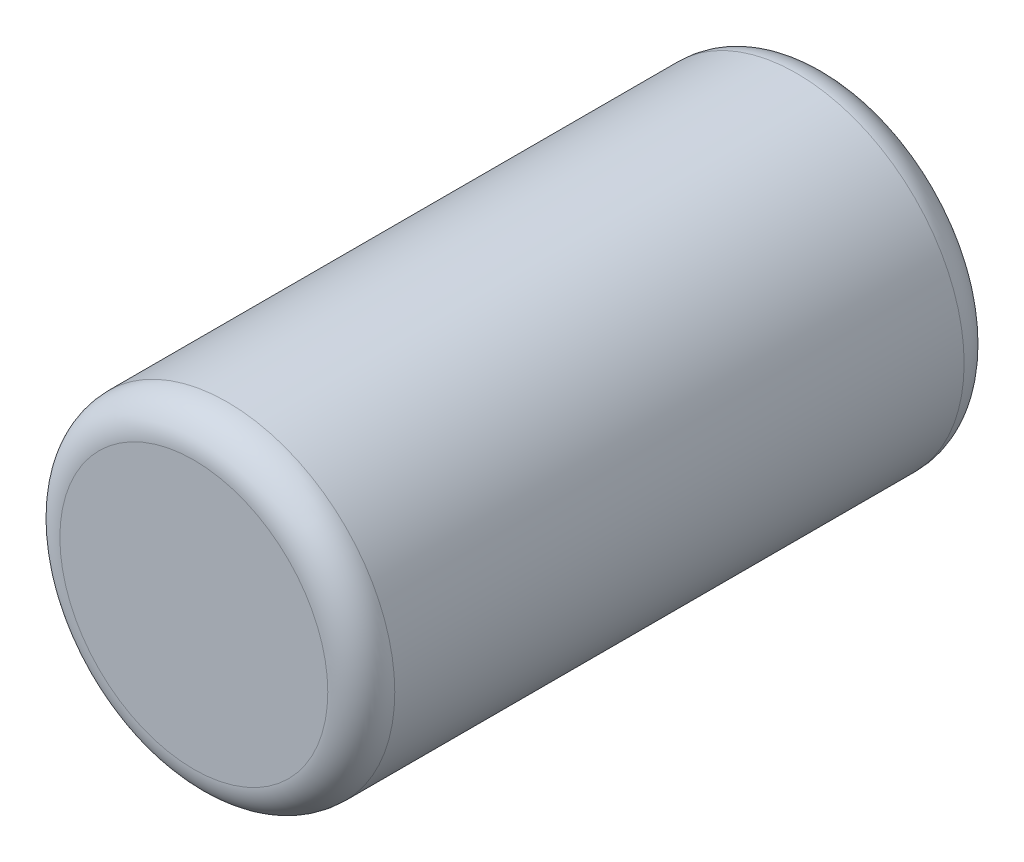
from build123d import *

# Parameters (mm, degrees)
SKETCH1_R           = 5
BOSS_EXTRUDE1_DEPTH = 9.5
FILLET1_R           = 1


with BuildPart() as part:
    # Sketch1 → Boss-Extrude1 (new, symmetric)
    with BuildSketch(Plane.XY):
        Circle(SKETCH1_R)
    extrude(amount=BOSS_EXTRUDE1_DEPTH, both=True)

    # Fillet1
    fillet1_edges = [part.edges().sort_by_distance(p)[0] for p in [
        (-5, 0, -9.5),
        (-5, 0, 9.5),
    ]]
    fillet(fillet1_edges, radius=FILLET1_R)


solid = part.part
